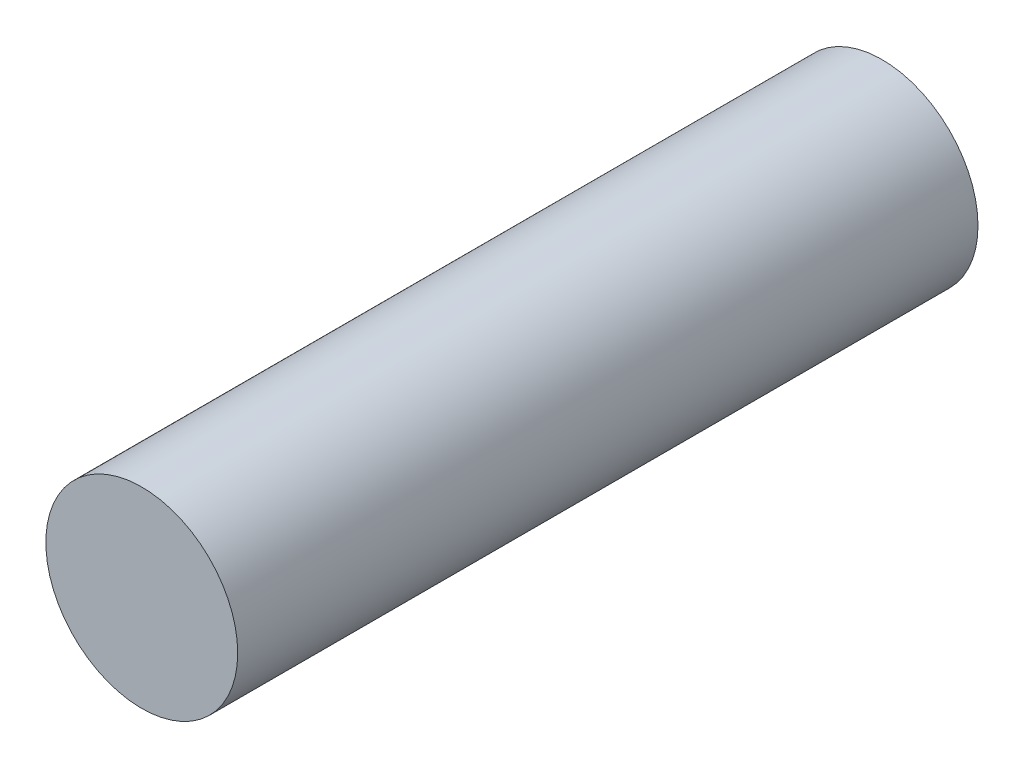
from build123d import *

# Parameters (mm, degrees)
SKETCH1_R           = 3.175
BOSS_EXTRUDE1_DEPTH = 24.5


with BuildPart() as part:
    # Sketch1 → Boss-Extrude1 (new body)
    with BuildSketch(Plane.XY):
        Circle(SKETCH1_R)
    extrude(amount=BOSS_EXTRUDE1_DEPTH)


solid = part.part
